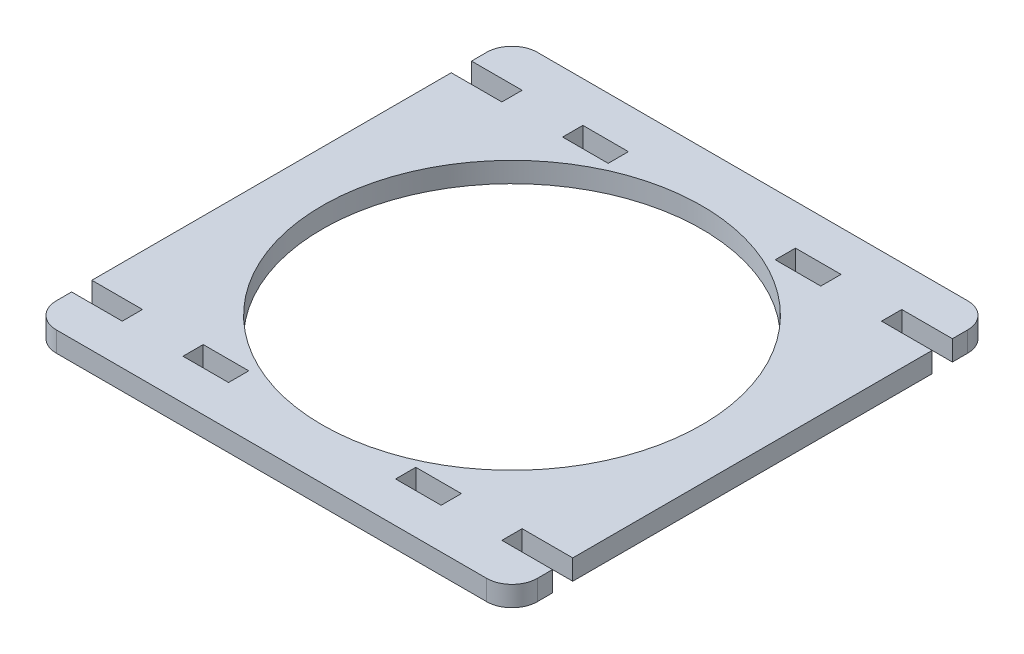
from build123d import *

# Parameters (mm, degrees)
SKETCH1_W           = 95
SKETCH1_H           = 95
SKETCH1_R           = 37.5
BOSS_EXTRUDE1_DEPTH = 2
SKETCH3_W           = 10
SKETCH3_H           = 4
SKETCH3_W_2         = 9
CUT_EXTRUDE5_DEPTH  = 68.294130502
FILLET1_R           = 5


with BuildPart() as part:
    # Sketch1 → Boss-Extrude1 (new, symmetric)
    with BuildSketch(Plane(origin=(0, 0, 0), x_dir=(1, 0, 0), z_dir=(0, 1, 0))):
        Rectangle(SKETCH1_W, SKETCH1_H)
        Circle(SKETCH1_R, mode=Mode.SUBTRACT)
    extrude(amount=BOSS_EXTRUDE1_DEPTH, both=True)

    # Sketch3 → Cut-Extrude5 (cut, through all)
    with BuildSketch(Plane(origin=(0, 2, 0), x_dir=(1, 0, 0), z_dir=(0, 1, 0))):
        with Locations((-42.5, -37.5)):
            Rectangle(SKETCH3_W, SKETCH3_H)
        with Locations((-42.5, 37.5)):
            Rectangle(SKETCH3_W, SKETCH3_H)
        with Locations((21, 37.5)):
            Rectangle(SKETCH3_W_2, SKETCH3_H)
        with Locations((42.5, -37.5)):
            Rectangle(SKETCH3_W, SKETCH3_H)
        with Locations((42.5, 37.5)):
            Rectangle(SKETCH3_W, SKETCH3_H)
        with Locations((21, -37.5)):
            Rectangle(SKETCH3_W_2, SKETCH3_H)
        with Locations((-21, -37.5)):
            Rectangle(SKETCH3_W_2, SKETCH3_H)
        with Locations((-21, 37.5)):
            Rectangle(SKETCH3_W_2, SKETCH3_H)
    extrude(amount=-CUT_EXTRUDE5_DEPTH, mode=Mode.SUBTRACT)

    # Fillet1
    fillet1_edges = [part.edges().sort_by_distance(p)[0] for p in [
        (-47.5, 0, 47.5),
        (47.5, 0, 47.5),
        (47.5, 0, -47.5),
        (-47.5, 0, -47.5),
    ]]
    fillet(fillet1_edges, radius=FILLET1_R)


solid = part.part
